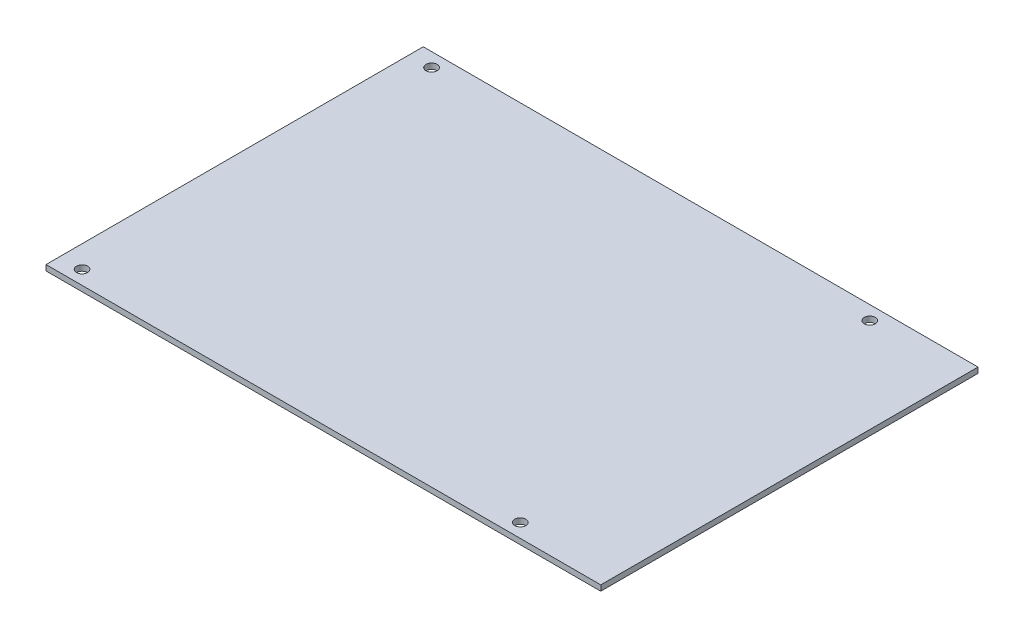
from build123d import *

# Parameters (mm, degrees)
SKETCH_1_W          = 100
SKETCH_1_H          = 68
EXTRUDE_1_DEPTH     = 1
SKETCH_2_R          = 1
CUT_EXTRUDE_1_DEPTH = 10


with BuildPart() as part:
    # Эскиз1 → Бобышка-Вытянуть1 (new body)
    with BuildSketch(Plane(origin=(0, 0, 0), x_dir=(1, 0, 0), z_dir=(0, 1, 0))):
        Rectangle(SKETCH_1_W, SKETCH_1_H)
    extrude(amount=EXTRUDE_1_DEPTH)

    # Эскиз2 → Вырез-Вытянуть1 (cut)
    with BuildSketch(Plane(origin=(0, 1, 0), x_dir=(1, 0, 0), z_dir=(0, 1, 0))):
        with Locations(Location((-46, 31.5, 0), (0, 0, 270))):
            Circle(SKETCH_2_R)
        with Locations(Location((33, 31.5, 0), (0, 0, 270))):
            Circle(SKETCH_2_R)
        with Locations(Location((33, -31.5, 0), (0, 0, 270))):
            Circle(SKETCH_2_R)
        with Locations(Location((-46, -31.5, 0), (0, 0, 270))):
            Circle(SKETCH_2_R)
    extrude(amount=-CUT_EXTRUDE_1_DEPTH, mode=Mode.SUBTRACT)


solid = part.part
